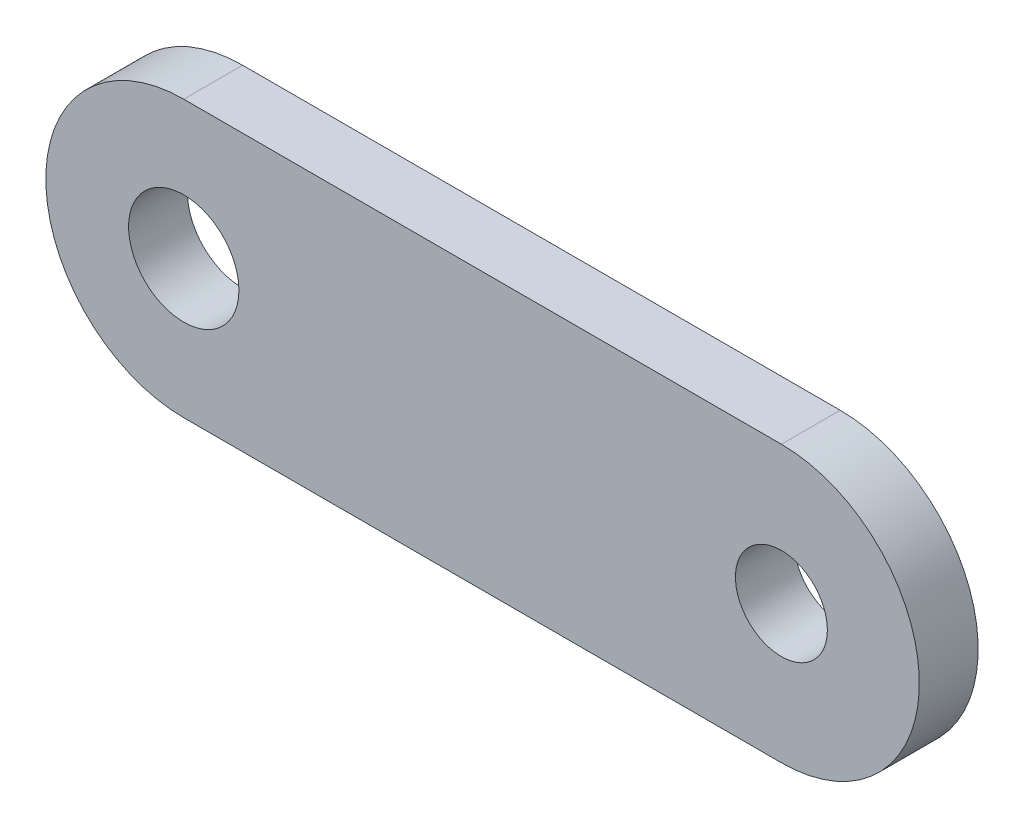
from build123d import *

# Parameters (mm, degrees)
SKETCH1_R           = 1.5875
SKETCH1_R_2         = 1.905
BOSS_EXTRUDE1_DEPTH = 1.016


with BuildPart() as part:
    # Sketch1 → Boss-Extrude1 (new, symmetric)
    with BuildSketch(Plane.XY):
        with BuildLine():
            Line((-71.739999898, -4.7625), (-92.374999898, -4.7625))
            ThreePointArc((-92.374999898, -4.7625), (-97.137499898, 0), (-92.374999898, 4.7625))
            Line((-92.374999898, 4.7625), (-71.739999898, 4.7625))
            ThreePointArc((-71.739999898, 4.7625), (-66.977499898, 0), (-71.739999898, -4.7625))
        make_face()
        with Locations((-71.739999898, 0)):
            Circle(SKETCH1_R, mode=Mode.SUBTRACT)
        with Locations((-92.374999898, 0)):
            Circle(SKETCH1_R_2, mode=Mode.SUBTRACT)
    extrude(amount=BOSS_EXTRUDE1_DEPTH, both=True)


solid = part.part
